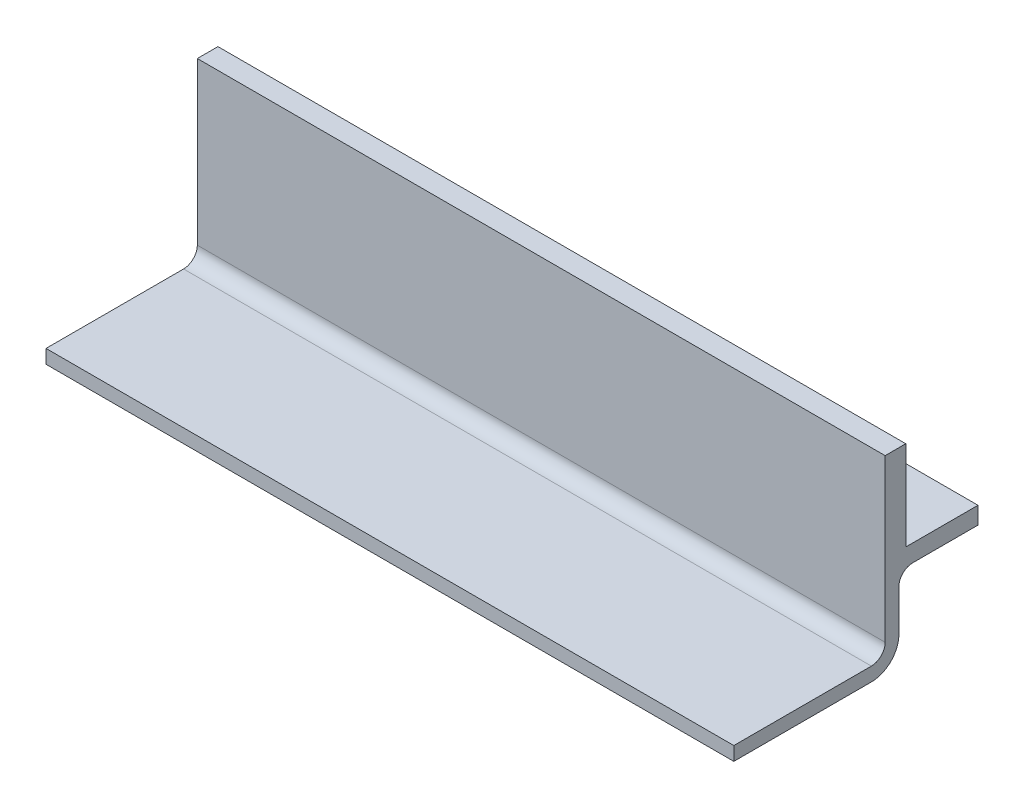
from build123d import *

# Parameters (mm, degrees)
SCHIZZO1_W                               = 100
SCHIZZO1_H                               = 35.499999851
ESTRUSIONE_ESTRUSIONE1_DEPTH             = 27.500000373
SCHIZZO2_W                               = 11.499999851
SCHIZZO2_H                               = 12
TAGLIO_ESTRUSIONE1_DEPTH                 = 116.927779361
SCHIZZO3_W                               = 10.499999851
SCHIZZO3_H                               = 13.000000006
TAGLIO_ESTRUSIONE2_DEPTH                 = 116.927779361
SCHIZZO4_W                               = 22
SCHIZZO4_H                               = 25.500000373
TAGLIO_ESTRUSIONE3_DEPTH                 = 116.927779361
FORO_SVASATO_PER_VITE_M3_5_1_D           = 4
FORO_SVASATO_PER_VITE_M3_5_1_DEPTH       = 15.500000373
FORO_SVASATO_PER_VITE_M3_5_1_CSINK_D     = 6.6
FORO_SVASATO_PER_VITE_M3_5_1_CSINK_ANGLE = 90
RACCORDO1_R                              = 2
RACCORDO2_R                              = 4


with BuildPart() as part:
    # Schizzo1 → Estrusione-Estrusione1 (new body)
    with BuildSketch(Plane(origin=(0, -9.5, 0), x_dir=(1, 0, 0), z_dir=(0, 1, 0))):
        with Locations((50, -27.750000075)):
            Rectangle(SCHIZZO1_W, SCHIZZO1_H)
    extrude(amount=-ESTRUSIONE_ESTRUSIONE1_DEPTH)

    # Schizzo2 → Taglio-Estrusione1 (cut, through all)
    with BuildSketch(Plane.ZY):
        with Locations((15.750000075, -31.000000373)):
            Rectangle(SCHIZZO2_W, SCHIZZO2_H)
    extrude(amount=-TAGLIO_ESTRUSIONE1_DEPTH, mode=Mode.SUBTRACT)

    # Schizzo3 → Taglio-Estrusione2 (cut, through all)
    with BuildSketch(Plane.ZY):
        with Locations((15.250000075, -16.000000003)):
            Rectangle(SCHIZZO3_W, SCHIZZO3_H)
    extrude(amount=-TAGLIO_ESTRUSIONE2_DEPTH, mode=Mode.SUBTRACT)

    # Schizzo4 → Taglio-Estrusione3 (cut, through all)
    with BuildSketch(Plane.ZY):
        with Locations((34.5, -22.250000186)):
            Rectangle(SCHIZZO4_W, SCHIZZO4_H)
    extrude(amount=-TAGLIO_ESTRUSIONE3_DEPTH, mode=Mode.SUBTRACT)

    # Foro svasato per Vite M3.5-1
    with Locations(Plane(origin=(0, -25.000000373, 0), x_dir=(-1, 0, 0), z_dir=(0, -1, 0))):
        with Locations((-15, -14.500000046), (-85, -14.500000046)):
            CounterSinkHole(FORO_SVASATO_PER_VITE_M3_5_1_D / 2, FORO_SVASATO_PER_VITE_M3_5_1_CSINK_D / 2, depth=FORO_SVASATO_PER_VITE_M3_5_1_DEPTH, counter_sink_angle=FORO_SVASATO_PER_VITE_M3_5_1_CSINK_ANGLE)

    # Raccordo1
    raccordo1_edges = [part.edges().sort_by_distance(p)[0] for p in [
        (50, -25.000000373, 21.5),
        (50, -35.000000373, 23.5),
    ]]
    fillet(raccordo1_edges, radius=RACCORDO1_R)

    # Raccordo2
    raccordo2_edges = [part.edges().sort_by_distance(p)[0] for p in [
        (50, -37.000000373, 21.5),
    ]]
    fillet(raccordo2_edges, radius=RACCORDO2_R)


solid = part.part
